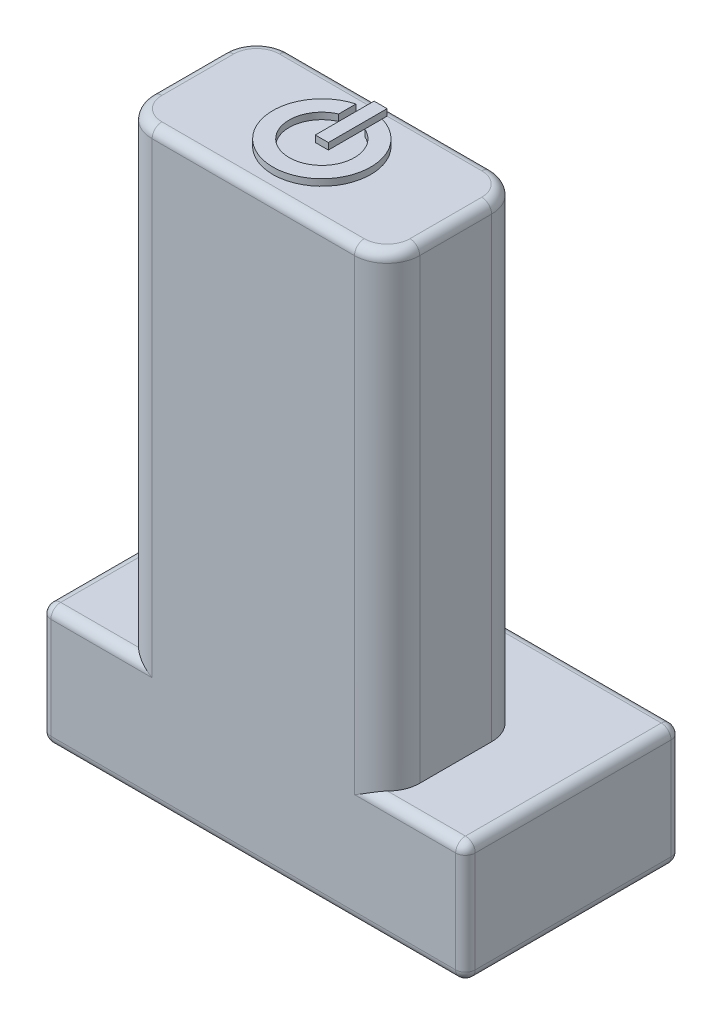
from build123d import *

# Parameters (mm, degrees)
SKETCH_1_W          = 8.2
SKETCH_1_H          = 4.2
EXTRUDE_1_DEPTH     = 18
SKETCH_2_W          = 13
SKETCH_2_H          = 9
SKETCH_2_W_2        = 8.2
SKETCH_2_H_2        = 4.2
EXTRUDE_2_DEPTH     = 3.7
FILLET_1_R          = 1
FILLET_2_R          = 0.3
EXTRUDE_3_DEPTH     = 0.2
CUT_EXTRUDE_1_DEPTH = 10
FILLET_3_R          = 0.3


with BuildPart() as part:
    # 草图1 → 凸台-拉伸1 (new body)
    with BuildSketch(Plane(origin=(0, 0, 0), x_dir=(1, 0, 0), z_dir=(0, 1, 0))):
        with Locations((11.994336416, 2.5)):
            Rectangle(SKETCH_1_W, SKETCH_1_H)
    extrude(amount=EXTRUDE_1_DEPTH)

    # 草图2 → 凸台-拉伸2 (add)
    with BuildSketch(Plane.XZ):
        with Locations((11.994336416, -2.5)):
            Rectangle(SKETCH_2_W, SKETCH_2_H)
        with Locations((11.994336416, -2.5)):
            Rectangle(SKETCH_2_W_2, SKETCH_2_H_2, mode=Mode.SUBTRACT)
    extrude(amount=-EXTRUDE_2_DEPTH)

    # 圆角1
    fillet_1_edges = [part.edges().sort_by_distance(p)[0] for p in [
        (7.894336416, 10.85, -4.6),
        (16.094336416, 10.85, -4.6),
        (16.094336416, 10.85, -0.4),
        (7.894336416, 10.85, -0.4),
    ]]
    fillet(fillet_1_edges, radius=FILLET_1_R)

    # 圆角2
    fillet_2_edges = [part.edges().sort_by_distance(p)[0] for p in [
        (11.994336416, 3.7, 2),
        (5.494336416, 1.85, 2),
        (18.494336416, 3.7, -2.5),
        (18.494336416, 1.85, 2),
        (11.994336416, 3.7, -7),
        (18.494336416, 1.85, -7),
        (5.494336416, 3.7, -2.5),
        (5.494336416, 1.85, -7),
        (11.994336416, 18, -4.6),
        (16.094336416, 18, -2.5),
        (7.894336416, 18, -2.5),
        (11.994336416, 18, -0.4),
        (8.187229635, 18, -0.692893219),
        (8.187229635, 18, -4.307106781),
        (15.801443197, 18, -0.692893219),
        (15.801443197, 18, -4.307106781),
    ]]
    fillet(fillet_2_edges, radius=FILLET_2_R)

    # 草图3 → 凸台-拉伸3 (add)
    with BuildSketch(Plane(origin=(0, 18, 0), x_dir=(1, 0, 0), z_dir=(0, 1, 0))):
        Polygon((11.994336416, 2.5), (12.194336416, 2.5), (12.194336416, 4.3), (11.794336416, 4.3), (11.794336416, 2.5), align=None)
        with BuildLine():
            Line((11.594336416, 3.416515139), (11.594336416, 3.945683229))
            ThreePointArc((11.594336416, 3.945683229), (11.994336416, 1), (12.394336416, 3.945683229))
            Line((12.394336416, 3.945683229), (12.394336416, 3.416515139))
            ThreePointArc((12.394336416, 3.416515139), (11.994336416, 1.5), (11.594336416, 3.416515139))
        make_face()
    extrude(amount=EXTRUDE_3_DEPTH)

    # 草图4 → 切除-拉伸1 (cut)
    with BuildSketch(Plane(origin=(0, 3.7, 0), x_dir=(1, 0, 0), z_dir=(0, 1, 0))):
        Polygon((11.994336416, 0.4), (4.788962203, 0.4), (4.788962203, -2.393061312), (19.340992476, -2.393061312), (19.340992476, 0.4), align=None)
    extrude(amount=-CUT_EXTRUDE_1_DEPTH, mode=Mode.SUBTRACT)

    # 圆角3
    fillet_3_edges = [part.edges().sort_by_distance(p)[0] for p in [
        (18.40646845, 3.612132034, -0.4),
        (5.494336416, 0, -3.55),
        (5.582204382, 3.612132034, -0.4),
        (5.494336416, 1.7, -0.4),
        (18.494336416, 1.7, -0.4),
        (11.994336416, 0, -0.4),
        (16.644336416, 3.7, -0.4),
        (7.344336416, 3.7, -0.4),
        (18.494336416, 0, -3.55),
        (11.994336416, 0, -7),
        (5.582204382, 0, -6.912132034),
        (18.40646845, 0, -6.912132034),
    ]]
    fillet(fillet_3_edges, radius=FILLET_3_R)


solid = part.part
